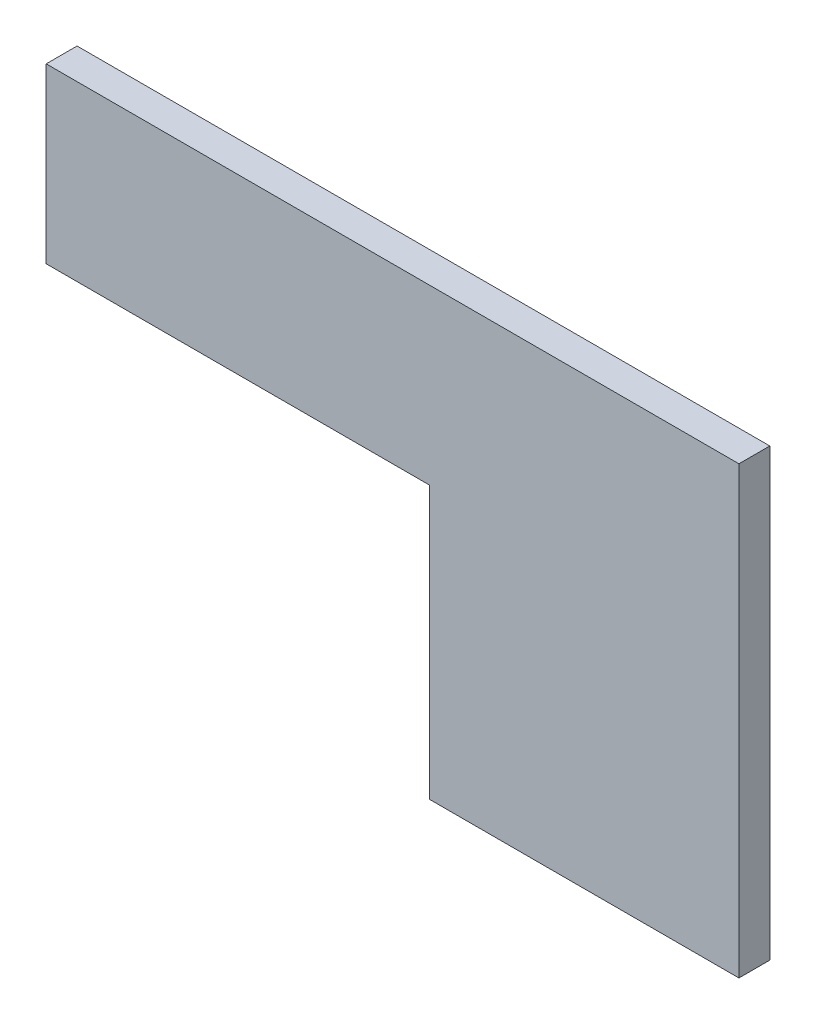
from build123d import *

# Parameters (mm, degrees)
SKETCH1_W           = 177.8
SKETCH1_H           = 114.3
BOSS_EXTRUDE1_DEPTH = 7.9248
SKETCH2_W           = 98.425
SKETCH2_H           = 69.85
CUT_EXTRUDE1_DEPTH  = 212.518633825


with BuildPart() as part:
    # Sketch1 → Boss-Extrude1 (new body)
    with BuildSketch(Plane.XY):
        with Locations((88.9, 57.15)):
            Rectangle(SKETCH1_W, SKETCH1_H)
    extrude(amount=BOSS_EXTRUDE1_DEPTH)

    # Sketch2 → Cut-Extrude1 (cut, through all)
    with BuildSketch(Plane.XY):
        with Locations((49.2125, 34.925)):
            Rectangle(SKETCH2_W, SKETCH2_H)
    extrude(amount=CUT_EXTRUDE1_DEPTH, mode=Mode.SUBTRACT)


solid = part.part
